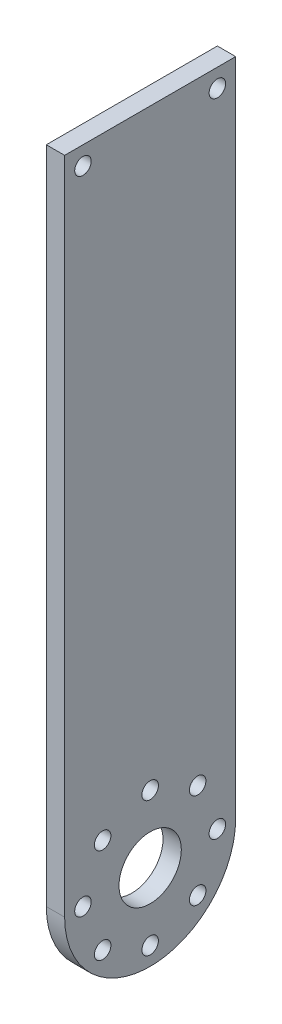
from build123d import *

# Parameters (mm, degrees)
SKETCH_1_R      = 1.35
SKETCH_1_R_2    = 5.1
EXTRUDE_1_DEPTH = 3


with BuildPart() as part:
    # 草图1 → 凸台-拉伸1 (new body)
    with BuildSketch(Plane(origin=(0, 0, 0), x_dir=(0, 0, -1), z_dir=(1, 0, 0))):
        with BuildLine():
            Line((-14, 0), (-14, 108))
            Line((-14, 108), (14, 108))
            Line((14, 108), (14, 0))
            ThreePointArc((14, 0), (0, -14), (-14, 0))
        make_face()
        with Locations((0, -11)):
            Circle(SKETCH_1_R, mode=Mode.SUBTRACT)
        with Locations((-7.778174593, -7.778174593)):
            Circle(SKETCH_1_R, mode=Mode.SUBTRACT)
        with Locations((-11, 0)):
            Circle(SKETCH_1_R, mode=Mode.SUBTRACT)
        with Locations((-7.778174593, 7.778174593)):
            Circle(SKETCH_1_R, mode=Mode.SUBTRACT)
        with Locations((0, 11)):
            Circle(SKETCH_1_R, mode=Mode.SUBTRACT)
        with Locations((7.778174593, 7.778174593)):
            Circle(SKETCH_1_R, mode=Mode.SUBTRACT)
        with Locations((11, 0)):
            Circle(SKETCH_1_R, mode=Mode.SUBTRACT)
        with Locations((7.778174593, -7.778174593)):
            Circle(SKETCH_1_R, mode=Mode.SUBTRACT)
        Circle(SKETCH_1_R_2, mode=Mode.SUBTRACT)
        with Locations((-11, 105)):
            Circle(SKETCH_1_R, mode=Mode.SUBTRACT)
        with Locations(Location((11, 105, 0), (0, 0, 180))):
            Circle(SKETCH_1_R, mode=Mode.SUBTRACT)
    extrude(amount=EXTRUDE_1_DEPTH)


solid = part.part
